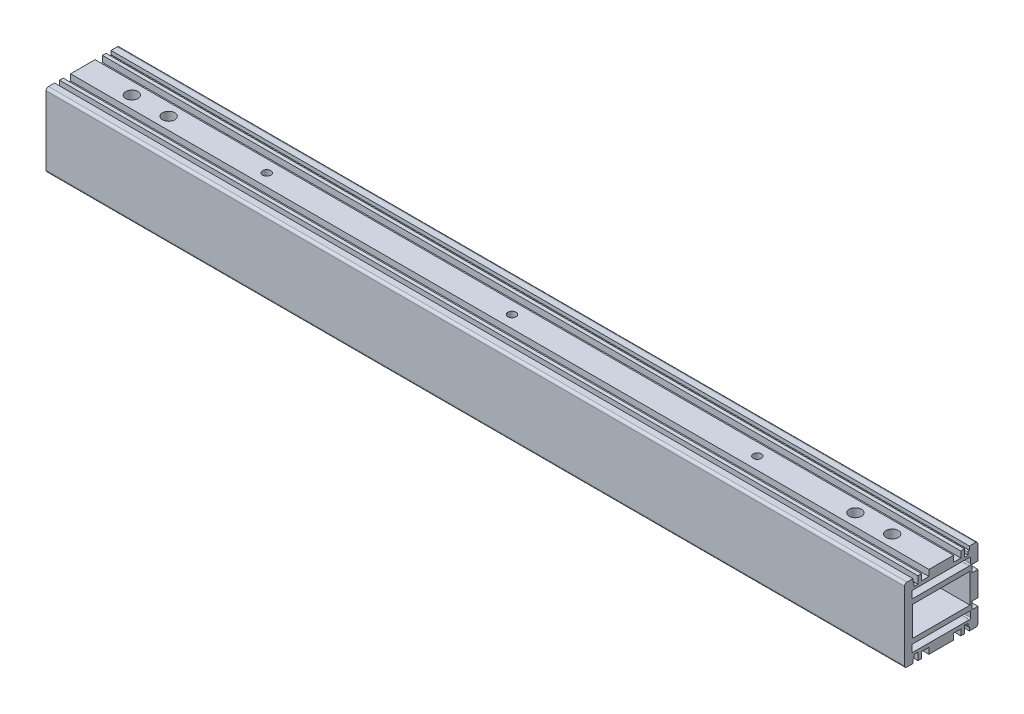
from build123d import *

# Parameters (mm, degrees)
SKETCH_1_W             = 23.5
SKETCH_1_H             = 12
EXTRUDE_1_DEPTH        = 175
HOLE_WIZARD_M6_1_D     = 5
HOLE_WIZARD_M6_1_DEPTH = 15
HOLE_WIZARD_M6_1_TIP   = 1.502151548
HOLE_WIZARD_M6_2_D     = 5
HOLE_WIZARD_M6_2_DEPTH = 15
HOLE_WIZARD_M6_2_TIP   = 1.502151548
HOLE_WIZARD_M4_1_D     = 3.3
HOLE_WIZARD_M4_1_DEPTH = 10.1
HOLE_WIZARD_M4_1_TIP   = 0.991420021
HOLE_WIZARD_M6_3_D     = 5
HOLE_WIZARD_M6_3_DEPTH = 15
HOLE_WIZARD_M6_3_TIP   = 1.502151548


with BuildPart() as part:
    # 草图1 → 凸台-拉伸1 (new, symmetric)
    with BuildSketch(Plane(origin=(0, 0, 0), x_dir=(0, 0, -1), z_dir=(1, 0, 0))):
        with BuildLine():
            Line((-14, 15), (-11.5, 15))
            Line((-11.5, 15), (-11.5, 13.5))
            Line((-11.5, 13.5), (-11.4, 13.5))
            ThreePointArc((-11.4, 13.5), (-11.117157288, 13.382842712), (-11, 13.1))
            Line((-11, 13.1), (-11, 12))
            Line((-11, 12), (-9.5, 12))
            Line((-9.5, 12), (-9.5, 15))
            Line((-9.5, 15), (-8, 15))
            Line((-8, 15), (-8, 12.5))
            Line((-8, 12.5), (-5, 12.5))
            Line((-5, 12.5), (-5, 15))
            Line((-5, 15), (5, 15))
            Line((5, 15), (5, 12.5))
            Line((5, 12.5), (8, 12.5))
            Line((8, 12.5), (8, 15))
            Line((8, 15), (9.5, 15))
            Line((9.5, 15), (9.5, 12))
            Line((9.5, 12), (11, 12))
            Line((11, 12), (11, 13.1))
            ThreePointArc((11, 13.1), (11.117157288, 13.382842712), (11.4, 13.5))
            Line((11.4, 13.5), (11.5, 13.5))
            Line((11.5, 13.5), (11.5, 15))
            Line((11.5, 15), (14, 15))
            ThreePointArc((14, 15), (14.707106781, 14.707106781), (15, 14))
            Line((15, 14), (15, 8))
            Line((15, 8), (12.5, 8))
            Line((12.5, 8), (12.5, 5))
            Line((12.5, 5), (15, 5))
            Line((15, 5), (15, -5))
            Line((15, -5), (12.5, -5))
            Line((12.5, -5), (12.5, -8))
            Line((12.5, -8), (15, -8))
            Line((15, -8), (15, -14))
            ThreePointArc((15, -14), (14.707106781, -14.707106781), (14, -15))
            Line((14, -15), (11.5, -15))
            Line((11.5, -15), (11.5, -13.5))
            Line((11.5, -13.5), (11.4, -13.5))
            ThreePointArc((11.4, -13.5), (11.117157288, -13.382842712), (11, -13.1))
            Line((11, -13.1), (11, -12))
            Line((11, -12), (9.5, -12))
            Line((9.5, -12), (9.5, -15))
            Line((9.5, -15), (8, -15))
            Line((8, -15), (8, -12.5))
            Line((8, -12.5), (5, -12.5))
            Line((5, -12.5), (5, -15))
            Line((5, -15), (-5, -15))
            Line((-5, -15), (-5, -12.5))
            Line((-5, -12.5), (-8, -12.5))
            Line((-8, -12.5), (-8, -15))
            Line((-8, -15), (-9.5, -15))
            Line((-9.5, -15), (-9.5, -12))
            Line((-9.5, -12), (-11, -12))
            Line((-11, -12), (-11, -13.1))
            ThreePointArc((-11, -13.1), (-11.117157288, -13.382842712), (-11.4, -13.5))
            Line((-11.4, -13.5), (-11.5, -13.5))
            Line((-11.5, -13.5), (-11.5, -15))
            Line((-11.5, -15), (-14, -15))
            ThreePointArc((-14, -15), (-14.707106781, -14.707106781), (-15, -14))
            Line((-15, -14), (-15, 14))
            ThreePointArc((-15, 14), (-14.707106781, 14.707106781), (-14, 15))
        make_face()
        with BuildLine():
            Line((12, -10.5), (12, -8.5))
            ThreePointArc((12, -8.5), (11.853553391, -8.146446609), (11.5, -8))
            Line((11.5, -8), (-11.5, -8))
            ThreePointArc((-11.5, -8), (-11.853553391, -8.146446609), (-12, -8.5))
            Line((-12, -8.5), (-12, -10.5))
            ThreePointArc((-12, -10.5), (-11.853553391, -10.853553391), (-11.5, -11))
            Line((-11.5, -11), (11.5, -11))
            ThreePointArc((11.5, -11), (11.853553391, -10.853553391), (12, -10.5))
        make_face(mode=Mode.SUBTRACT)
        with BuildLine():
            Line((-11.5, 11), (11.5, 11))
            ThreePointArc((11.5, 11), (11.853553391, 10.853553391), (12, 10.5))
            Line((12, 10.5), (12, 8.5))
            ThreePointArc((12, 8.5), (11.853553391, 8.146446609), (11.5, 8))
            Line((11.5, 8), (-11.5, 8))
            ThreePointArc((-11.5, 8), (-11.853553391, 8.146446609), (-12, 8.5))
            Line((-12, 8.5), (-12, 10.5))
            ThreePointArc((-12, 10.5), (-11.853553391, 10.853553391), (-11.5, 11))
        make_face(mode=Mode.SUBTRACT)
        Rectangle(SKETCH_1_W, SKETCH_1_H, mode=Mode.SUBTRACT)
    extrude(amount=EXTRUDE_1_DEPTH, both=True)

    # M6 螺纹孔1
    with Locations(Plane.XZ.offset(15)):
        with Locations((-155, 0), (-140, 0), (155, 0), (140, 0)):
            Hole(HOLE_WIZARD_M6_1_D / 2, depth=HOLE_WIZARD_M6_1_DEPTH)
            with Locations((0, 0, -(HOLE_WIZARD_M6_1_DEPTH + HOLE_WIZARD_M6_1_TIP / 2))):  # 118° drill point
                Cone(0, HOLE_WIZARD_M6_1_D / 2, HOLE_WIZARD_M6_1_TIP, mode=Mode.SUBTRACT)

    # M6 螺纹孔2
    with Locations(Plane(origin=(0, 15, 0), x_dir=(-1, 0, 0), z_dir=(0, 1, 0))):
        with Locations((155, 0), (140, 0), (-155, 0), (-140, 0)):
            Hole(HOLE_WIZARD_M6_2_D / 2, depth=HOLE_WIZARD_M6_2_DEPTH)
            with Locations((0, 0, -(HOLE_WIZARD_M6_2_DEPTH + HOLE_WIZARD_M6_2_TIP / 2))):  # 118° drill point
                Cone(0, HOLE_WIZARD_M6_2_D / 2, HOLE_WIZARD_M6_2_TIP, mode=Mode.SUBTRACT)

    # M4 螺纹孔1
    with Locations(Plane(origin=(0, 15, 0), x_dir=(-1, 0, 0), z_dir=(0, 1, 0))):
        with Locations((100, 0), (0, 0), (-100, 0)):
            Hole(HOLE_WIZARD_M4_1_D / 2, depth=HOLE_WIZARD_M4_1_DEPTH)
            with Locations((0, 0, -(HOLE_WIZARD_M4_1_DEPTH + HOLE_WIZARD_M4_1_TIP / 2))):  # 118° drill point
                Cone(0, HOLE_WIZARD_M4_1_D / 2, HOLE_WIZARD_M4_1_TIP, mode=Mode.SUBTRACT)

    # M6 螺纹孔3
    with Locations(Plane.XZ.offset(15)):
        with Locations((-105, 0), (105, 0)):
            Hole(HOLE_WIZARD_M6_3_D / 2, depth=HOLE_WIZARD_M6_3_DEPTH)
            with Locations((0, 0, -(HOLE_WIZARD_M6_3_DEPTH + HOLE_WIZARD_M6_3_TIP / 2))):  # 118° drill point
                Cone(0, HOLE_WIZARD_M6_3_D / 2, HOLE_WIZARD_M6_3_TIP, mode=Mode.SUBTRACT)


solid = part.part
